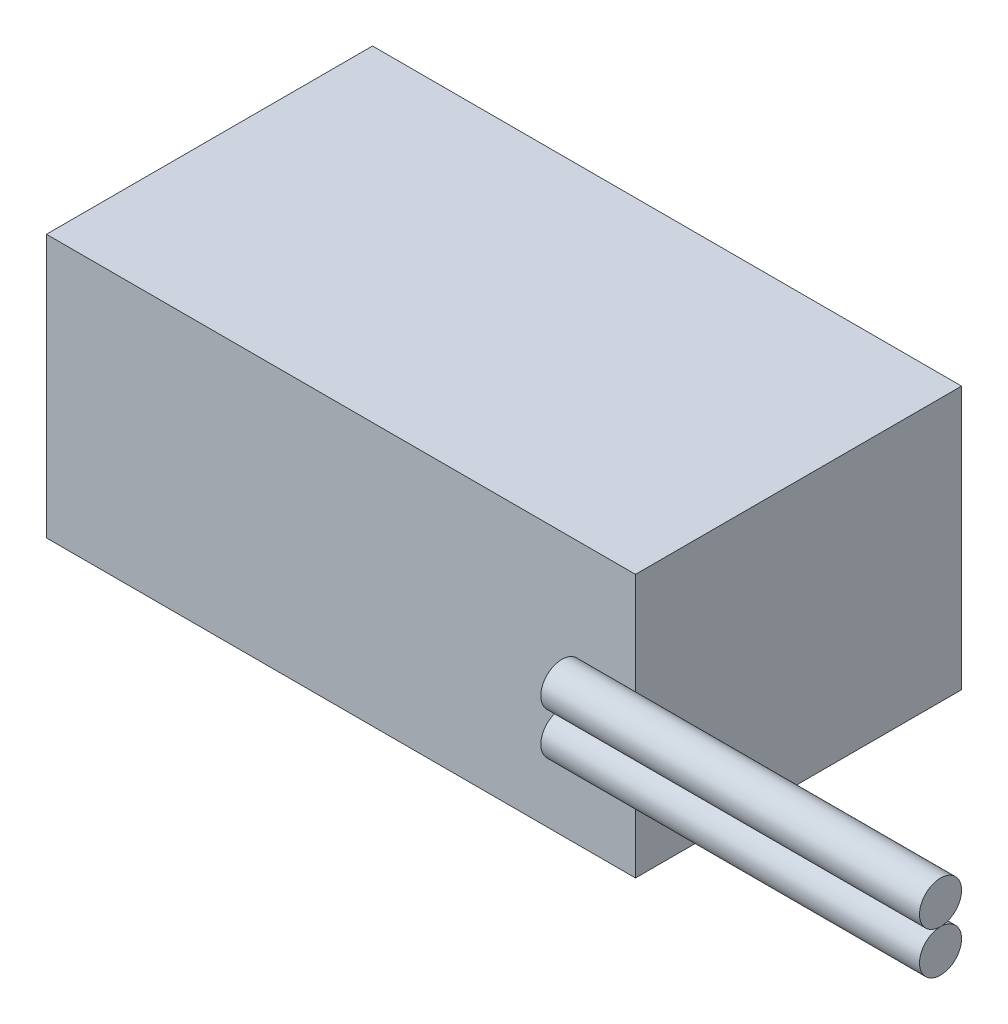
from build123d import *

# Parameters (mm, degrees)
SKETCH1_W                  = 56
SKETCH1_H                  = 25
BOSS_EXTRUDE1_DEPTH        = 15.5
BOSS_EXTRUDE2_DEPTH        = 31
BOSS_EXTRUDE2_DEPTH_BACK   = 5
SKETCH2_R                  = 2
BOSS_EXTRUDE2_2_DEPTH      = 31
BOSS_EXTRUDE2_2_DEPTH_BACK = 5


with BuildPart() as part:
    # Sketch1 → Boss-Extrude1 (new, symmetric)
    with BuildSketch(Plane.XY):
        Rectangle(SKETCH1_W, SKETCH1_H)
    extrude(amount=BOSS_EXTRUDE1_DEPTH, both=True)


with BuildPart() as body_2:
    # Sketch2 → Boss-Extrude2 (new, two sides: drawn at the far end of the back side and taken through both)
    with BuildSketch(Plane(origin=(28, 0, 0), x_dir=(0, 0, -1), z_dir=(1, 0, 0)).offset(-BOSS_EXTRUDE2_DEPTH_BACK)):
        with Locations((-17.5, 2)):
            Circle(SKETCH2_R)
    extrude(amount=BOSS_EXTRUDE2_DEPTH + BOSS_EXTRUDE2_DEPTH_BACK)


with BuildPart() as body_3:
    # Sketch2 → Boss-Extrude2 2 (new, two sides: drawn at the far end of the back side and taken through both)
    with BuildSketch(Plane(origin=(28, 0, 0), x_dir=(0, 0, -1), z_dir=(1, 0, 0)).offset(-BOSS_EXTRUDE2_2_DEPTH_BACK)):
        with Locations((-17.5, -2)):
            Circle(SKETCH2_R)
    extrude(amount=BOSS_EXTRUDE2_2_DEPTH + BOSS_EXTRUDE2_2_DEPTH_BACK)


solid = Compound([part.part, body_2.part, body_3.part])
